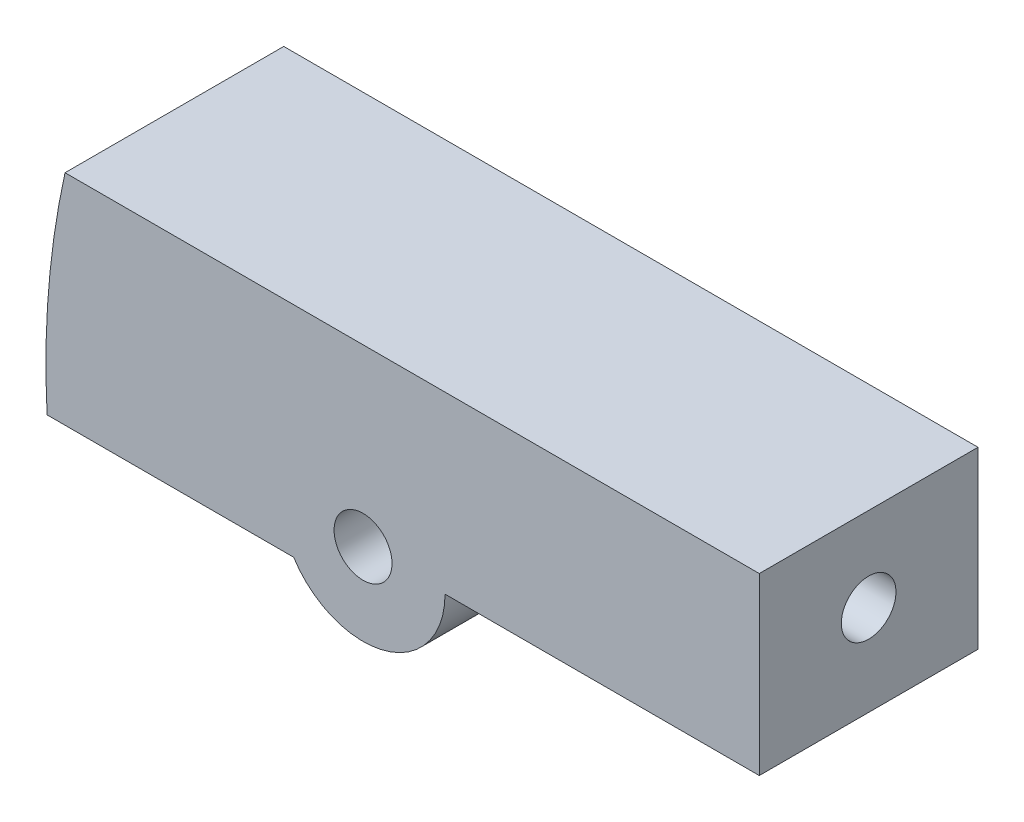
from build123d import *

# Parameters (mm, degrees)
SKETCH2_R           = 2.65
BOSS_EXTRUDE1_DEPTH = 10
SKETCH4_R           = 75.7
SKETCH4_R_2         = 74
CUT_EXTRUDE5_DEPTH  = 80.915518032
SKETCH5_W           = 3
SKETCH5_H           = 16
CUT_EXTRUDE6_DEPTH  = 79.307087942


with BuildPart() as part:
    # Sketch2 → Boss-Extrude1 (new, symmetric)
    with BuildSketch(Plane.XY):
        with BuildLine():
            ThreePointArc((-73.989796594, 16), (-75.457580373, 6.053392794), (-75.594245813, -4))
            Line((-75.594245813, -4), (-51.34428877, -4))
            ThreePointArc((-51.34428877, -4), (-42.918193786, -7.205281597), (-37.5, 0))
            Line((-37.5, 0), (-5.763957799, 0))
            Line((-5.763957799, 0), (-5.763957799, 16))
            Line((-5.763957799, 16), (-73.989796594, 16))
        make_face()
        with Locations((-45, 0)):
            Circle(SKETCH2_R, mode=Mode.SUBTRACT)
    extrude(amount=BOSS_EXTRUDE1_DEPTH, both=True)

    # Sketch3 → Cut-Revolve1 (revolve, cut)
    with BuildSketch(Plane.XY, mode=Mode.PRIVATE) as cut_revolve1_sk:
        Polygon((-76.243604379, 8.3), (-75.243604379, 8.3), (-55.276091822, 8.3), (11.256395621, 8.3), (11.256395621, 10.8), (-23.743604379, 10.8), (-25.243604379, 12.3), (-48.243604379, 12.3), (-49.243604379, 13.3), (-70.243604379, 13.3), (-76.243604379, 13.3), align=None)
        Polygon((-76.243604379, 16.3), (-76.243604379, 13.3), (-70.243604379, 13.3), align=None)
    revolve(cut_revolve1_sk.sketch.rotate(Axis((-75.243604379, 8.3, 0), (1, 0, 0)), 90), axis=Axis((-75.243604379, 8.3, 0), (1, 0, 0)), mode=Mode.SUBTRACT)

    # Sketch4 → Cut-Extrude5 (cut, through all)
    with BuildSketch(Plane(origin=(0, 0, -10), x_dir=(-1, 0, 0), z_dir=(0, 0, -1))):
        Circle(SKETCH4_R)
        Circle(SKETCH4_R_2, mode=Mode.SUBTRACT)
    extrude(amount=-CUT_EXTRUDE5_DEPTH, mode=Mode.SUBTRACT)

    # Sketch5 → Cut-Extrude6 (cut, through all)
    with BuildSketch(Plane(origin=(0, 0, -10), x_dir=(-1, 0, 0), z_dir=(0, 0, -1))):
        with Locations((7.263957799, 8)):
            Rectangle(SKETCH5_W, SKETCH5_H)
    extrude(amount=-CUT_EXTRUDE6_DEPTH, mode=Mode.SUBTRACT)


solid = part.part
